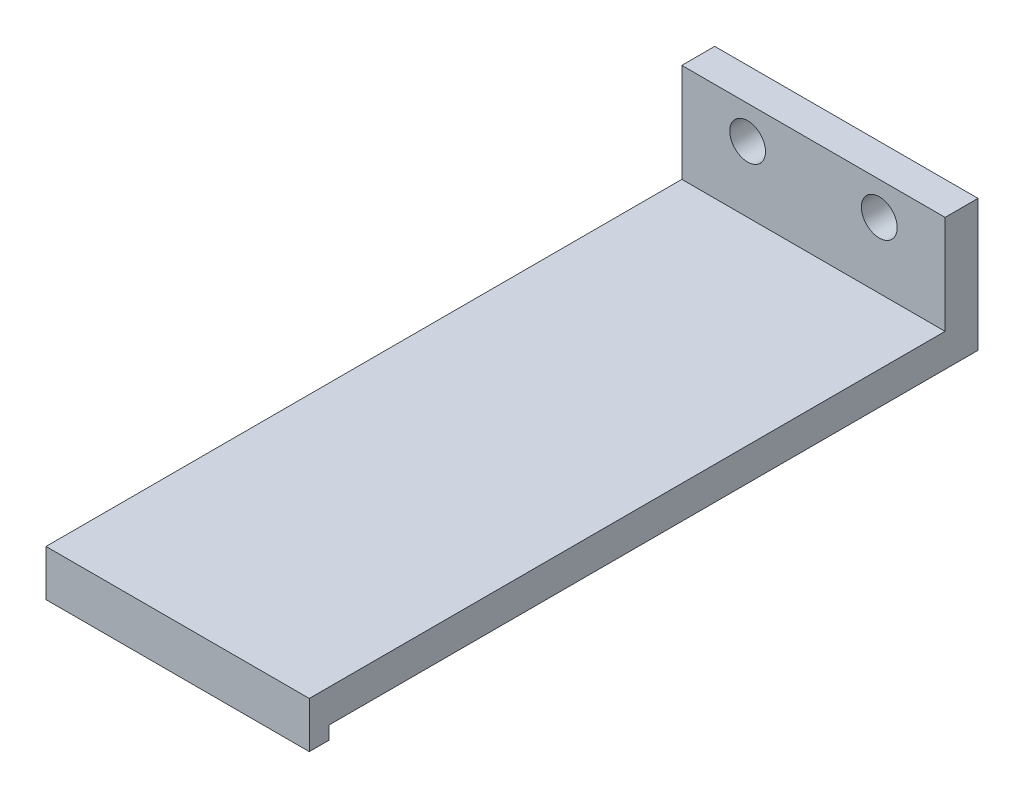
from build123d import *

# Parameters (mm, degrees)
SKETCH1_W           = 25.4
SKETCH1_H           = 12.7
BOSS_EXTRUDE1_DEPTH = 3.175
CUT_EXTRUDE1_DEPTH  = 3.175
SKETCH3_W           = 25.4
SKETCH3_H           = 3.175
BOSS_EXTRUDE2_DEPTH = 61.341
SKETCH4_W           = 25.4
SKETCH4_H           = 1.905
BOSS_EXTRUDE3_DEPTH = 1.27


with BuildPart() as part:
    # Sketch1 → Boss-Extrude1 (new body)
    with BuildSketch(Plane.XY):
        with Locations((4.390957447, -0.776861702)):
            Rectangle(SKETCH1_W, SKETCH1_H)
    extrude(amount=BOSS_EXTRUDE1_DEPTH)

    # Sketch2 → Cut-Extrude1 (cut)
    with BuildSketch(Plane.XY.offset(3.175)):
        with BuildLine():
            ThreePointArc((12.468157447, 2.398138298), (11.962272279, 3.61945313), (10.740957447, 4.125338298))
            Line((10.740957447, 4.125338298), (10.740957447, 0.670938298))
            ThreePointArc((10.740957447, 0.670938298), (11.962272279, 1.176823465), (12.468157447, 2.398138298))
        make_face()
        with BuildLine():
            Line((10.740957447, 0.670938298), (10.740957447, 4.125338298))
            ThreePointArc((10.740957447, 4.125338298), (9.013757447, 2.398138298), (10.740957447, 0.670938298))
        make_face()
        with BuildLine():
            ThreePointArc((-0.231842553, 2.398138298), (-0.737727721, 3.61945313), (-1.959042553, 4.125338298))
            Line((-1.959042553, 4.125338298), (-1.959042553, 0.670938298))
            ThreePointArc((-1.959042553, 0.670938298), (-0.737727721, 1.176823465), (-0.231842553, 2.398138298))
        make_face()
        with BuildLine():
            Line((-1.959042553, 0.670938298), (-1.959042553, 4.125338298))
            ThreePointArc((-1.959042553, 4.125338298), (-3.686242553, 2.398138298), (-1.959042553, 0.670938298))
        make_face()
    extrude(amount=-CUT_EXTRUDE1_DEPTH, mode=Mode.SUBTRACT)

    # Sketch3 → Boss-Extrude2 (add)
    with BuildSketch(Plane.XY.offset(3.175)):
        with Locations((4.390957447, -5.539361702)):
            Rectangle(SKETCH3_W, SKETCH3_H)
    extrude(amount=BOSS_EXTRUDE2_DEPTH)

    # Sketch4 → Boss-Extrude3 (add)
    with BuildSketch(Plane.XZ.offset(7.126861702)):
        with Locations((4.390957447, 63.5635)):
            Rectangle(SKETCH4_W, SKETCH4_H)
    extrude(amount=BOSS_EXTRUDE3_DEPTH)


solid = part.part
